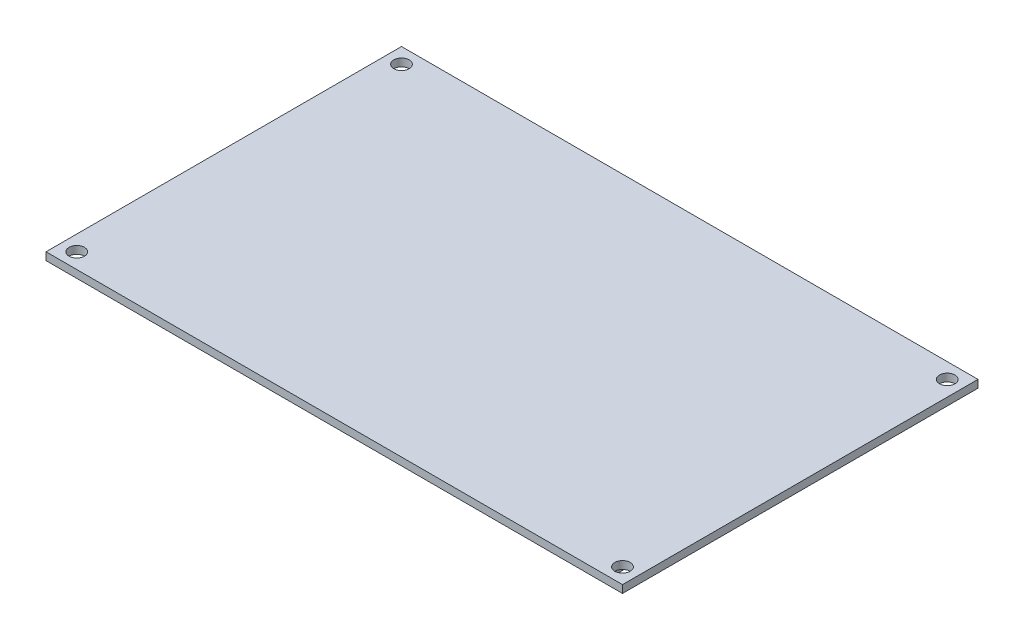
from build123d import *

# Parameters (mm, degrees)
SKETCH_1_W      = 120
SKETCH_1_H      = 74
SKETCH_1_R      = 1.6
EXTRUDE_2_DEPTH = 1.6
SKETCH_2_W      = 105.5
SKETCH_2_H      = 67.2
EXTRUDE_3_DEPTH = 3.1


with BuildPart() as part:
    # 草图1 → 凸台-拉伸2 (new body)
    with BuildSketch(Plane(origin=(0, 0, 0), x_dir=(1, 0, 0), z_dir=(0, 1, 0))):
        Rectangle(SKETCH_1_W, SKETCH_1_H)
        with Locations(Location((-56.8, 33.8, 0), (0, 0, 270))):
            Circle(SKETCH_1_R, mode=Mode.SUBTRACT)
        with Locations(Location((-56.8, -33.8, 0), (0, 0, 90))):
            Circle(SKETCH_1_R, mode=Mode.SUBTRACT)
        with Locations(Location((56.8, -33.8, 0), (0, 0, 270))):
            Circle(SKETCH_1_R, mode=Mode.SUBTRACT)
        with Locations(Location((56.8, 33.8, 0), (0, 0, 90))):
            Circle(SKETCH_1_R, mode=Mode.SUBTRACT)
    extrude(amount=EXTRUDE_2_DEPTH)

    # 草图2 → 凸台-拉伸3 (add)
    with BuildSketch(Plane.XZ):
        Rectangle(SKETCH_2_W, SKETCH_2_H)
    extrude(amount=EXTRUDE_3_DEPTH)


solid = part.part
